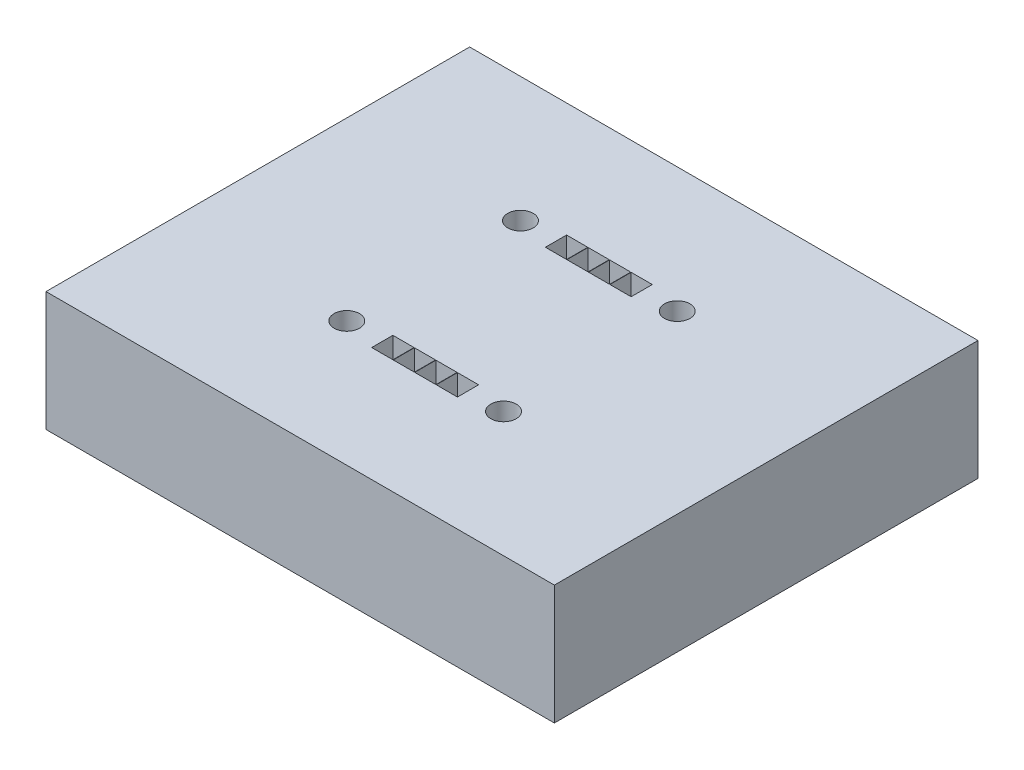
from build123d import *

# Parameters (mm, degrees)
ESQUISSE1_W             = 60
ESQUISSE1_H             = 50
BOSS_EXTRU_2_DEPTH      = 14.1
ESQUISSE2_R             = 1.5
ESQUISSE2_W             = 2.5
ESQUISSE2_H             = 2.5
ENL_V_MAT_EXTRU_1_DEPTH = 42.518790927


with BuildPart() as part:
    # Esquisse1 → Boss.-Extru.2 (new body)
    with BuildSketch(Plane(origin=(0, 0, 0), x_dir=(1, 0, 0), z_dir=(0, 1, 0))):
        Rectangle(ESQUISSE1_W, ESQUISSE1_H)
    extrude(amount=BOSS_EXTRU_2_DEPTH)

    # Esquisse2 → Enlèv. mat.-Extru.1 (cut, through all)
    with BuildSketch(Plane(origin=(0, 14.1, 0), x_dir=(1, 0, 0), z_dir=(0, 1, 0))):
        with Locations(Location((-9.25, 10.25, 0), (0, 0, 270))):
            Circle(ESQUISSE2_R)
        with Locations(Location((9.25, 10.25, 0), (0, 0, 270))):
            Circle(ESQUISSE2_R)
        with Locations(Location((9.25, -10.25, 0), (0, 0, 90))):
            Circle(ESQUISSE2_R)
        with Locations(Location((-9.25, -10.25, 0), (0, 0, 90))):
            Circle(ESQUISSE2_R)
        with Locations((3.81, -10.25)):
            Rectangle(ESQUISSE2_W, ESQUISSE2_H)
        with Locations((-3.81, 10.25)):
            Rectangle(ESQUISSE2_W, ESQUISSE2_H)
        with Locations((1.27, -10.25)):
            Rectangle(ESQUISSE2_W, ESQUISSE2_H)
        with Locations((-1.27, 10.25)):
            Rectangle(ESQUISSE2_W, ESQUISSE2_H)
        with Locations((1.27, 10.25)):
            Rectangle(ESQUISSE2_W, ESQUISSE2_H)
        with Locations((3.81, 10.25)):
            Rectangle(ESQUISSE2_W, ESQUISSE2_H)
        with Locations((-1.27, -10.25)):
            Rectangle(ESQUISSE2_W, ESQUISSE2_H)
        with Locations((-3.81, -10.25)):
            Rectangle(ESQUISSE2_W, ESQUISSE2_H)
    extrude(amount=-ENL_V_MAT_EXTRU_1_DEPTH, mode=Mode.SUBTRACT)


solid = part.part
